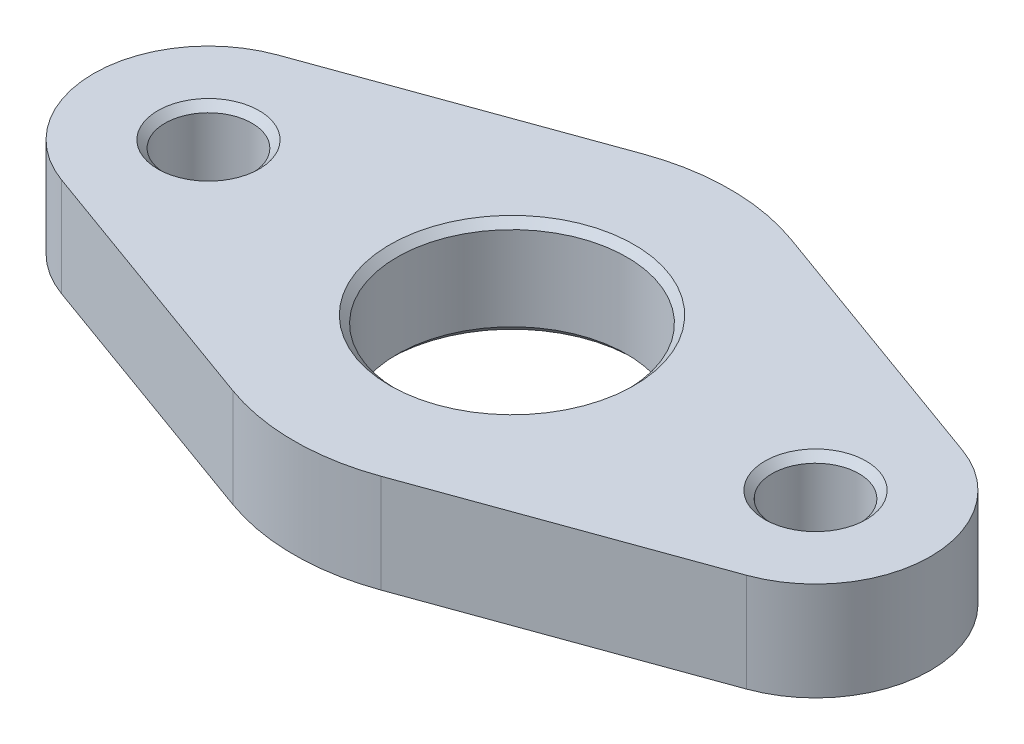
from build123d import *

# Parameters (mm, degrees)
SKETCH1_R           = 4.8
SKETCH1_R_2         = 12.7
BOSS_EXTRUDE1_DEPTH = 5.45
CHAMFER1_SIZE       = 0.8


with BuildPart() as part:
    # Sketch1 → Boss-Extrude1 (new, symmetric)
    with BuildSketch(Plane(origin=(0, 0, 0), x_dir=(1, 0, 0), z_dir=(0, 1, 0))):
        with BuildLine():
            Line((-37.865350224, 11.944360697), (-8.188971684, 22.666070298))
            ThreePointArc((-8.188971684, 22.666070298), (0, 24.1), (8.188971684, 22.666070298))
            Line((8.188971684, 22.666070298), (37.865350224, 11.944360697))
            ThreePointArc((37.865350224, 11.944360697), (46.25, 0), (37.865350224, -11.944360697))
            Line((37.865350224, -11.944360697), (8.188971684, -22.666070298))
            ThreePointArc((8.188971684, -22.666070298), (0, -24.1), (-8.188971684, -22.666070298))
            Line((-8.188971684, -22.666070298), (-37.865350224, -11.944360697))
            ThreePointArc((-37.865350224, -11.944360697), (-46.25, 0), (-37.865350224, 11.944360697))
        make_face()
        with Locations(Location((-33.55, 0, 0), (0, 0, 270))):
            Circle(SKETCH1_R, mode=Mode.SUBTRACT)
        with Locations(Location((33.55, 0, 0), (0, 0, 270))):
            Circle(SKETCH1_R, mode=Mode.SUBTRACT)
        with Locations(Location((0, 0, 0), (0, 0, 270))):
            Circle(SKETCH1_R_2, mode=Mode.SUBTRACT)
    extrude(amount=BOSS_EXTRUDE1_DEPTH, both=True)

    # Chamfer1
    chamfer1_edges = [part.edges().sort_by_distance(p)[0] for p in [
        (-33.55, -5.45, -4.8),
        (-33.55, 5.45, -4.8),
        (33.55, -5.45, -4.8),
        (33.55, 5.45, -4.8),
        (0, -5.45, -12.7),
        (0, 5.45, -12.7),
    ]]
    chamfer(chamfer1_edges, length=CHAMFER1_SIZE)


solid = part.part
